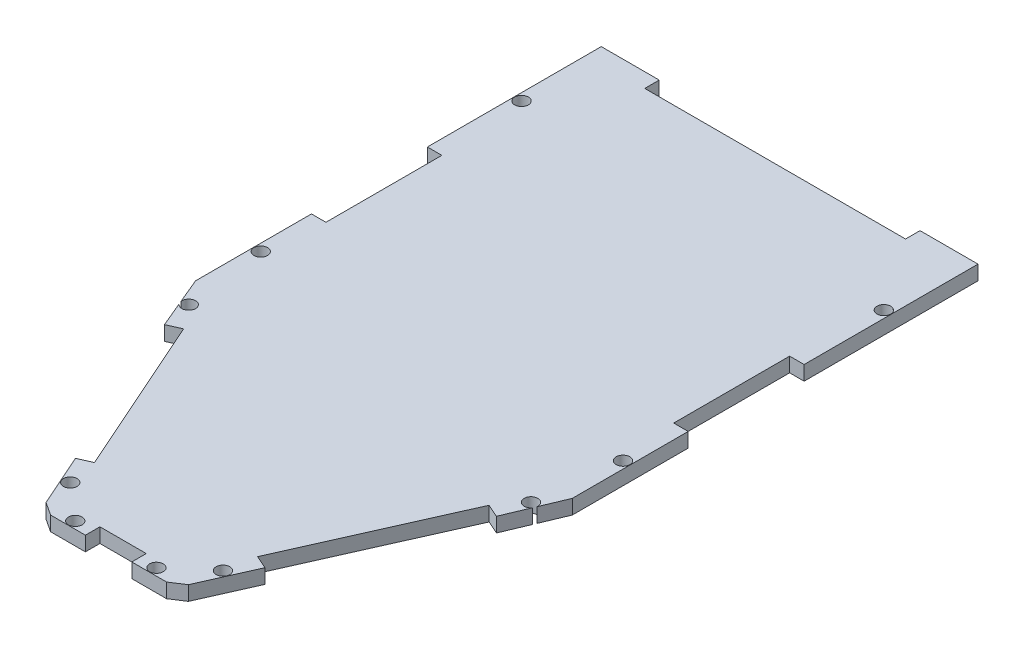
from build123d import *

# Parameters (mm, degrees)
BOSS_EXTRUDE1_DEPTH = 3.175
SKETCH2_R           = 1.5
SKETCH2_R_2         = 1.500000048
CUT_EXTRUDE1_DEPTH  = 99.065877093


with BuildPart() as part:
    # Sketch1 → Boss-Extrude1 (new body)
    with BuildSketch(Plane(origin=(0, 0, 0), x_dir=(1, 0, 0), z_dir=(0, 1, 0))):
        Polygon((-41.275, 0), (-36.368301991, -11.713851401), (-33.466950324, -10.424361771), (-17.857958519, -45.544593333), (-20.759310186, -46.834082962), (-15.601351667, -58.43948963), (-12.7, -60.325), (-5.08, -60.325), (-5.08, -57.15), (5.08, -57.15), (5.08, -60.325), (12.7, -60.325), (15.601351667, -58.43948963), (20.759310186, -46.834082962), (17.857958519, -45.544593333), (33.466950324, -10.424361771), (36.368301991, -11.713851401), (41.275, 0), (41.275, 25.4), (38.1, 25.4), (38.1, 50.8), (41.275, 50.8), (41.275, 88.9), (28.575, 88.9), (28.575, 85.725), (3.175, 85.725), (-3.175, 85.725), (-28.575, 85.725), (-28.575, 88.9), (-41.275, 88.9), (-41.275, 50.8), (-38.1, 50.8), (-38.1, 25.4), (-41.275, 25.4), align=None)
    extrude(amount=BOSS_EXTRUDE1_DEPTH)

    # Sketch2 → Cut-Extrude1 (cut, through all)
    with BuildSketch(Plane(origin=(0, 0, 0), x_dir=(-1, 0, 0), z_dir=(0, -1, 0))):
        with Locations(Location((39.6875, 69.85, 0), (0, 0, 90))):
            Circle(SKETCH2_R)
        with Locations(Location((-8.89, -58.7375, 0), (0, 0, 270))):
            Circle(SKETCH2_R_2)
        with Locations(Location((39.6875, 12.7, 0), (0, 0, 90))):
            Circle(SKETCH2_R_2)
        with Locations((37.496605417, -5.266403252)):
            Circle(SKETCH2_R_2)
        with Locations(Location((16.729655093, -51.992041481, 0), (0, 0, 90))):
            Circle(SKETCH2_R_2)
        with Locations(Location((8.89, -58.7375, 0), (0, 0, 90))):
            Circle(SKETCH2_R_2)
        with Locations(Location((-16.729655093, -51.992041481, 0), (0, 0, 270))):
            Circle(SKETCH2_R_2)
        with Locations((-37.496605417, -5.266403252)):
            Circle(SKETCH2_R_2)
        with Locations(Location((-39.6875, 12.7, 0), (0, 0, 270))):
            Circle(SKETCH2_R_2)
        with Locations(Location((-39.6875, 69.85, 0), (0, 0, 270))):
            Circle(SKETCH2_R)
    extrude(amount=-CUT_EXTRUDE1_DEPTH, mode=Mode.SUBTRACT)


solid = part.part
